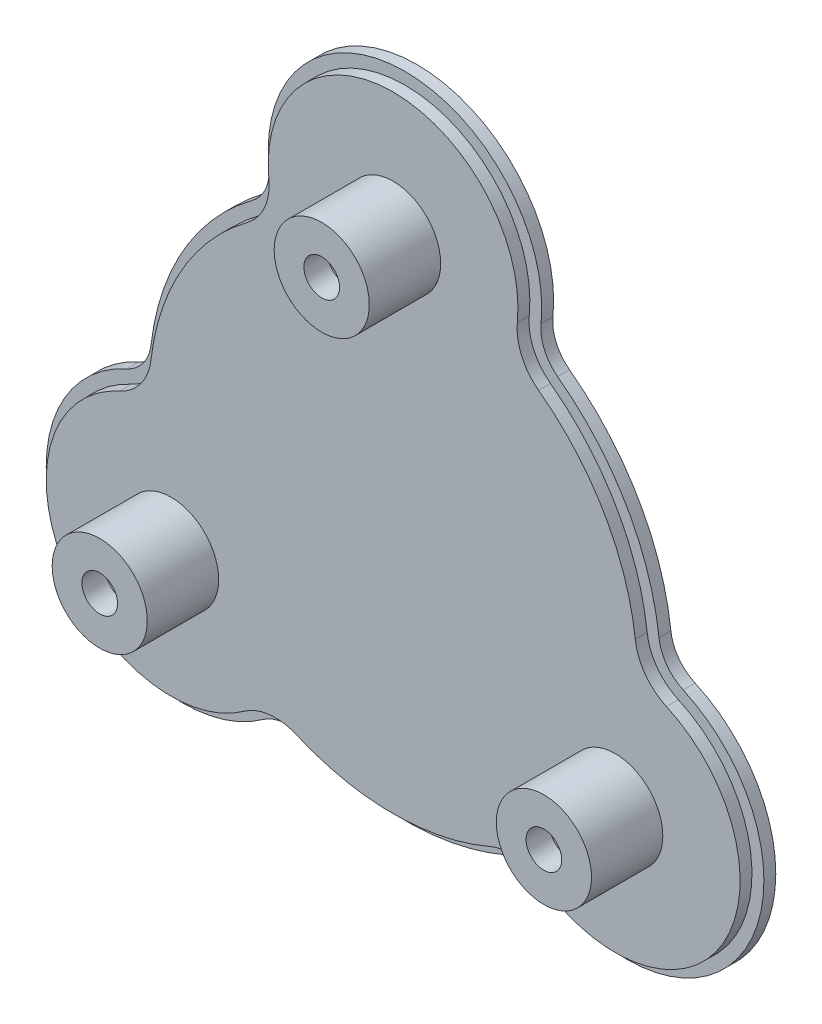
from build123d import *

# Parameters (mm, degrees)
SKETCH1_R           = 5.5
BOSS_EXTRUDE1_DEPTH = 4
CUT_EXTRUDE1_START  = -2
CUT_EXTRUDE1_DEPTH  = 2
SKETCH4_R           = 8
BOSS_EXTRUDE2_DEPTH = 16
SKETCH6_R           = 3
CUT_EXTRUDE2_DEPTH  = 4
SKETCH7_R           = 5.5
CUT_EXTRUDE3_DEPTH  = 91.325305156


with BuildPart() as part:
    # Sketch1 → Boss-Extrude1 (new body)
    with BuildSketch(Plane.XY):
        with BuildLine():
            ThreePointArc((22.877204778, 40.819588003), (-0.010726273, 66.124665414), (-22.890446501, 40.812163899))
            ThreePointArc((-22.890446501, 40.812163899), (-23.449446231, 37.285381871), (-25.675278589, 34.493188739))
            ThreePointArc((-25.675278589, 34.493188739), (-37.24257945, 21.493959056), (-42.711233264, 4.974992775))
            ThreePointArc((-42.711233264, 4.974992775), (-44.015348899, 1.650845578), (-46.789402571, -0.597553496))
            ThreePointArc((-46.789402571, -0.597553496), (-57.260276929, -33.071621932), (-23.89914747, -40.229790123))
            ThreePointArc((-23.89914747, -40.229790123), (-20.565364774, -38.950507076), (-17.034338411, -39.482037877))
            ThreePointArc((-17.034338411, -39.482037877), (0.006975154, -42.999999434), (17.047146505, -39.476509421))
            ThreePointArc((17.047146505, -39.476509421), (20.578000241, -38.943833092), (23.912197793, -40.222034507))
            ThreePointArc((23.912197793, -40.222034507), (57.271003202, -33.053043482), (46.789593971, -0.582373776))
            ThreePointArc((46.789593971, -0.582373776), (44.014811006, 1.665125206), (42.709617, 4.988849138))
            ThreePointArc((42.709617, 4.988849138), (37.235604296, 21.506040378), (25.664086758, 34.501516646))
            ThreePointArc((25.664086758, 34.501516646), (23.437348658, 37.292987514), (22.877204778, 40.819588003))
        make_face()
        with Locations((-0.006995377, 43.124665717)):
            Circle(SKETCH1_R, mode=Mode.SUBTRACT)
        with Locations((37.350553729, -21.556274684)):
            Circle(SKETCH1_R, mode=Mode.SUBTRACT)
        with Locations((-37.343558352, -21.568391032)):
            Circle(SKETCH1_R, mode=Mode.SUBTRACT)
    extrude(amount=BOSS_EXTRUDE1_DEPTH)

    # Sketch2 → Cut-Extrude1 (cut)
    with BuildSketch(Plane.XY.offset(4).offset(CUT_EXTRUDE1_START)):
        with BuildLine():
            ThreePointArc((22.877204778, 40.819588003), (23.437348658, 37.292987514), (25.664086758, 34.501516646))
            ThreePointArc((25.664086758, 34.501516646), (37.235604296, 21.506040378), (42.709617, 4.988849138))
            ThreePointArc((42.709617, 4.988849138), (44.014811006, 1.665125206), (46.789593971, -0.582373776))
            ThreePointArc((46.789593971, -0.582373776), (57.271003202, -33.053043482), (23.912197793, -40.222034507))
            ThreePointArc((23.912197793, -40.222034507), (20.578000241, -38.943833092), (17.047146505, -39.476509421))
            ThreePointArc((17.047146505, -39.476509421), (0.006975154, -42.999999434), (-17.034338411, -39.482037877))
            ThreePointArc((-17.034338411, -39.482037877), (-20.565364774, -38.950507076), (-23.89914747, -40.229790123))
            ThreePointArc((-23.89914747, -40.229790123), (-57.260276929, -33.071621932), (-46.789402571, -0.597553496))
            ThreePointArc((-46.789402571, -0.597553496), (-44.015348899, 1.650845578), (-42.711233264, 4.974992775))
            ThreePointArc((-42.711233264, 4.974992775), (-37.24257945, 21.493959056), (-25.675278589, 34.493188739))
            ThreePointArc((-25.675278589, 34.493188739), (-23.449446231, 37.285381871), (-22.890446501, 40.812163899))
            ThreePointArc((-22.890446501, 40.812163899), (-0.010726273, 66.124665414), (22.877204778, 40.819588003))
        make_face()
        with BuildLine():
            ThreePointArc((-24.481079585, 32.888854379), (-35.510366452, 20.49424003), (-40.724664275, 4.743597762))
            ThreePointArc((-40.724664275, 4.743597762), (-42.401384377, 0.469694224), (-45.968024813, -2.421104586))
            ThreePointArc((-45.968024813, -2.421104586), (-55.528388357, -32.071340985), (-25.068226677, -38.607059768))
            ThreePointArc((-25.068226677, -38.607059768), (-20.78193464, -36.962267279), (-16.242043601, -37.645664022))
            ThreePointArc((-16.242043601, -37.645664022), (0.006650729, -40.999999461), (16.25425597, -37.640392703))
            ThreePointArc((16.25425597, -37.640392703), (20.793925059, -36.955523138), (25.080750483, -38.598924957))
            ThreePointArc((25.080750483, -38.598924957), (55.538790204, -32.053324456), (45.968807863, -2.406191246))
            ThreePointArc((45.968807863, -2.406191246), (42.401229765, 0.483450301), (40.723123186, 4.756809644))
            ThreePointArc((40.723123186, 4.756809644), (35.503715724, 20.50575943), (24.470408304, 32.896794941))
            ThreePointArc((24.470408304, 32.896794941), (21.607459318, 36.485828914), (20.88727433, 41.020029543))
            ThreePointArc((20.88727433, 41.020029543), (-0.010401848, 64.12466544), (-20.900581186, 41.013251014))
            ThreePointArc((-20.900581186, 41.013251014), (-21.619295125, 36.478816977), (-24.481079585, 32.888854379))
        make_face(mode=Mode.SUBTRACT)
    extrude(amount=CUT_EXTRUDE1_DEPTH, mode=Mode.SUBTRACT)

    # Sketch4 → Boss-Extrude2 (add)
    with BuildSketch(Plane(origin=(0, 0, 0), x_dir=(-1, 0, 0), z_dir=(0, 0, -1))):
        with Locations((0.006995377, 43.124665717)):
            Circle(SKETCH4_R)
        with Locations((-37.350553729, -21.556274684)):
            Circle(SKETCH4_R)
        with Locations((37.343558352, -21.568391032)):
            Circle(SKETCH4_R)
    extrude(amount=-BOSS_EXTRUDE2_DEPTH)

    # Sketch6 → Cut-Extrude2 (cut)
    with BuildSketch(Plane.XY.offset(16)):
        with Locations((-0.006995377, 43.124665717)):
            Circle(SKETCH6_R)
        with Locations((-37.343558352, -21.568391032)):
            Circle(SKETCH6_R)
        with Locations((37.350553729, -21.556274684)):
            Circle(SKETCH6_R)
    extrude(amount=-CUT_EXTRUDE2_DEPTH, mode=Mode.SUBTRACT)

    # Sketch7 → Cut-Extrude3 (cut, through all)
    with BuildSketch(Plane.XY.offset(12)):
        with Locations((-0.006995377, 43.124665717)):
            Circle(SKETCH7_R)
        with Locations((-37.343558352, -21.568391032)):
            Circle(SKETCH7_R)
        with Locations((37.350553729, -21.556274684)):
            Circle(SKETCH7_R)
    extrude(amount=-CUT_EXTRUDE3_DEPTH, mode=Mode.SUBTRACT)


solid = part.part
